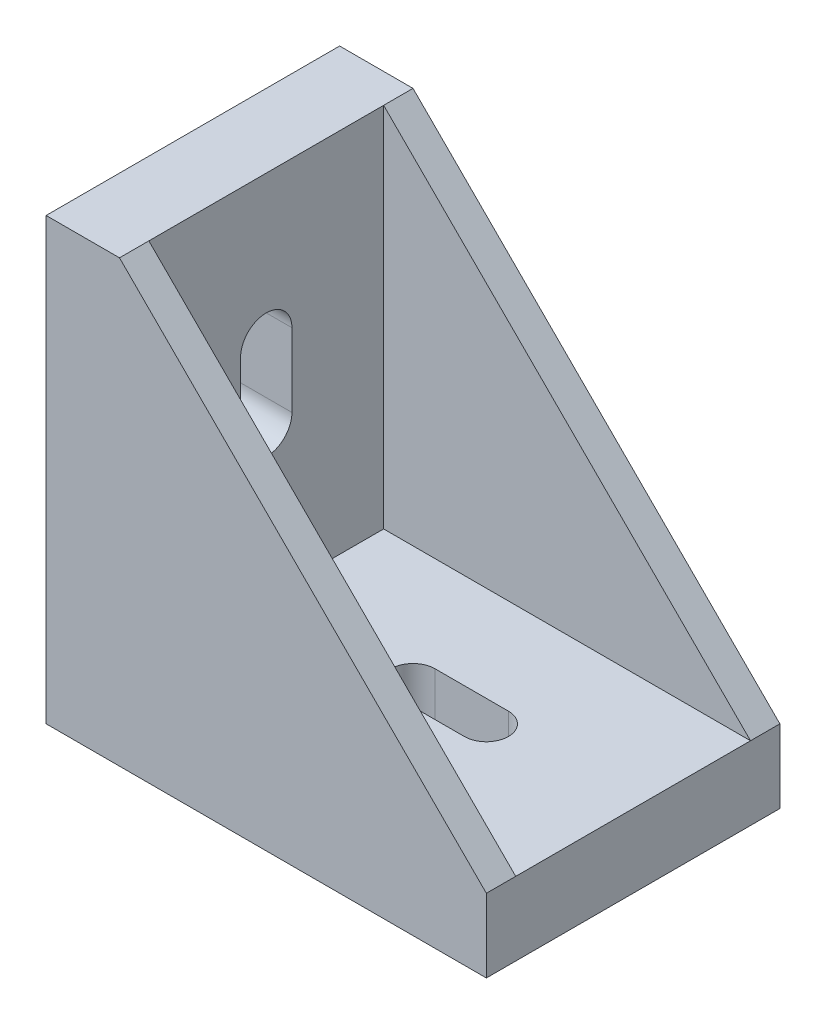
from build123d import *

# Parameters (mm, degrees)
EXTRUDE_1_DEPTH     = 20
SKETCH_3_W          = 16
SKETCH_3_H          = 25
CUT_EXTRUDE_1_DEPTH = 25
CUT_EXTRUDE_2_REACH = 45.875
CUT_EXTRUDE_3_REACH = 45.875


with BuildPart() as part:
    # 草圖1 → 填料-伸長1 (new body)
    with BuildSketch(Plane.XY):
        Polygon((0, 0), (0, -30), (30, -30), (30, -25), (5, 0), align=None)
    extrude(amount=-EXTRUDE_1_DEPTH)

    # 草圖3 → 除料-伸長1 (cut)
    with BuildSketch(Plane(origin=(30, 0, 0), x_dir=(0, 0, -1), z_dir=(1, 0, 0))):
        with Locations((10, -12.5)):
            Rectangle(SKETCH_3_W, SKETCH_3_H)
    extrude(amount=-CUT_EXTRUDE_1_DEPTH, mode=Mode.SUBTRACT)

    # 草圖4 → 除料-伸長2 (cut, up to next)
    with BuildSketch(Plane(origin=(5, 0, 0), x_dir=(0, 0, -1), z_dir=(1, 0, 0)), mode=Mode.PRIVATE) as cut_extrude_2_sk1:
        with BuildLine():
            Line((11.75, -10), (11.75, -15))
            ThreePointArc((11.75, -15), (10, -16.75), (8.25, -15))
            Line((8.25, -15), (8.25, -10))
            ThreePointArc((8.25, -10), (10, -8.25), (11.75, -10))
        make_face()
    cut_extrude_2_tool1 = extrude(cut_extrude_2_sk1.sketch, amount=-CUT_EXTRUDE_2_REACH, mode=Mode.PRIVATE) & part.part
    add(cut_extrude_2_tool1.solids().sort_by_distance((5, -12.5, -10))[0], mode=Mode.SUBTRACT)

    # 草圖5 → 除料-伸長3 (cut, up to next)
    with BuildSketch(Plane(origin=(0, -25, 0), x_dir=(1, 0, 0), z_dir=(0, 1, 0)), mode=Mode.PRIVATE) as cut_extrude_3_sk1:
        with BuildLine():
            Line((15, 11.5), (20, 11.5))
            ThreePointArc((20, 11.5), (21.5, 10), (20, 8.5))
            Line((20, 8.5), (15, 8.5))
            ThreePointArc((15, 8.5), (13.5, 10), (15, 11.5))
        make_face()
    cut_extrude_3_tool1 = extrude(cut_extrude_3_sk1.sketch, amount=-CUT_EXTRUDE_3_REACH, mode=Mode.PRIVATE) & part.part
    add(cut_extrude_3_tool1.solids().sort_by_distance((17.5, -25, -10))[0], mode=Mode.SUBTRACT)


solid = part.part
